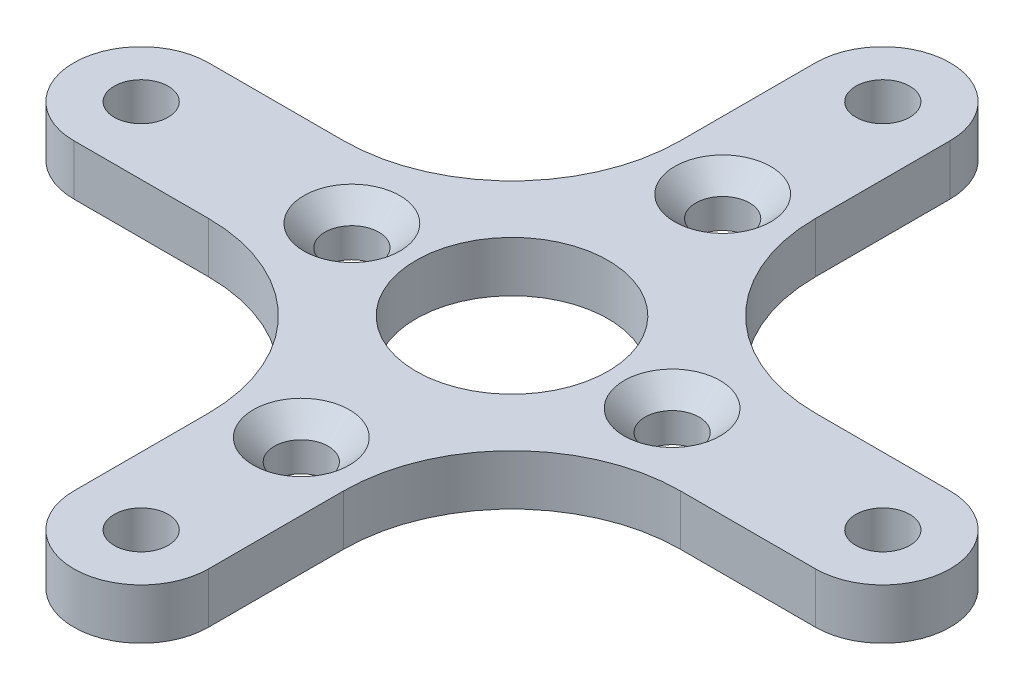
from build123d import *

# Parameters (mm, degrees)
BOSS_EXTRUDE1_DEPTH = 3
SKETCH2_R           = 1.6
CUT_EXTRUDE1_DEPTH  = 25
CHAMFER1_SIZE       = 1.25
FILLET1_R           = 10
SKETCH3_R           = 5.7
CUT_EXTRUDE2_DEPTH  = 3


with BuildPart() as part:
    # Sketch1 → Boss-Extrude1 (new body)
    with BuildSketch(Plane(origin=(0, 0, 0), x_dir=(1, 0, 0), z_dir=(0, 1, 0))):
        Polygon((4, 4), (4, 22), (-4, 22), (-4, 4), (-22, 4), (-22, -4), (-4, -4), (-4, -22), (4, -22), (4, -4), (22, -4), (22, 4), align=None)
        with BuildLine():
            ThreePointArc((-4, 22), (0, 26), (4, 22))
            Line((4, 22), (-4, 22))
        make_face()
        with BuildLine():
            ThreePointArc((22, 4), (26, 0), (22, -4))
            Line((22, -4), (22, 4))
        make_face()
        with BuildLine():
            Line((-22, 4), (-22, -4))
            ThreePointArc((-22, -4), (-26, 0), (-22, 4))
        make_face()
        with BuildLine():
            ThreePointArc((4, -22), (0, -26), (-4, -22))
            Line((-4, -22), (4, -22))
        make_face()
    extrude(amount=BOSS_EXTRUDE1_DEPTH)

    # Sketch2 → Cut-Extrude1 (cut)
    with BuildSketch(Plane(origin=(0, 3, 0), x_dir=(1, 0, 0), z_dir=(0, 1, 0))):
        with Locations(Location((-22, 0, 0), (0, 0, 270))):
            Circle(SKETCH2_R)
        with Locations(Location((0, 22, 0), (0, 0, 270))):
            Circle(SKETCH2_R)
        with Locations(Location((0, -22, 0), (0, 0, 270))):
            Circle(SKETCH2_R)
        with Locations(Location((22, 0, 0), (0, 0, 270))):
            Circle(SKETCH2_R)
        with Locations(Location((0, 12.5, 0), (0, 0, 270))):
            Circle(SKETCH2_R)
        with Locations(Location((-9.5, 0, 0), (0, 0, 270))):
            Circle(SKETCH2_R)
        with Locations(Location((0, -12.5, 0), (0, 0, 270))):
            Circle(SKETCH2_R)
        with Locations(Location((9.5, 0, 0), (0, 0, 270))):
            Circle(SKETCH2_R)
    extrude(amount=-CUT_EXTRUDE1_DEPTH, mode=Mode.SUBTRACT)

    # Chamfer1
    chamfer1_edges = [part.edges().sort_by_distance(p)[0] for p in [
        (9.5, 3, -1.6),
        (0, 3, 10.9),
        (-9.5, 3, -1.6),
        (0, 3, -14.1),
    ]]
    chamfer(chamfer1_edges, length=CHAMFER1_SIZE)

    # Fillet1
    fillet1_edges = [part.edges().sort_by_distance(p)[0] for p in [
        (4, 1.5, -4),
        (4, 1.5, 4),
        (-4, 1.5, 4),
        (-4, 1.5, -4),
    ]]
    fillet(fillet1_edges, radius=FILLET1_R)

    # Sketch3 → Cut-Extrude2 (cut)
    with BuildSketch(Plane(origin=(0, 3, 0), x_dir=(1, 0, 0), z_dir=(0, 1, 0))):
        with Locations(Location((0, 0, 0), (0, 0, 270))):
            Circle(SKETCH3_R)
    extrude(amount=-CUT_EXTRUDE2_DEPTH, mode=Mode.SUBTRACT)


solid = part.part
